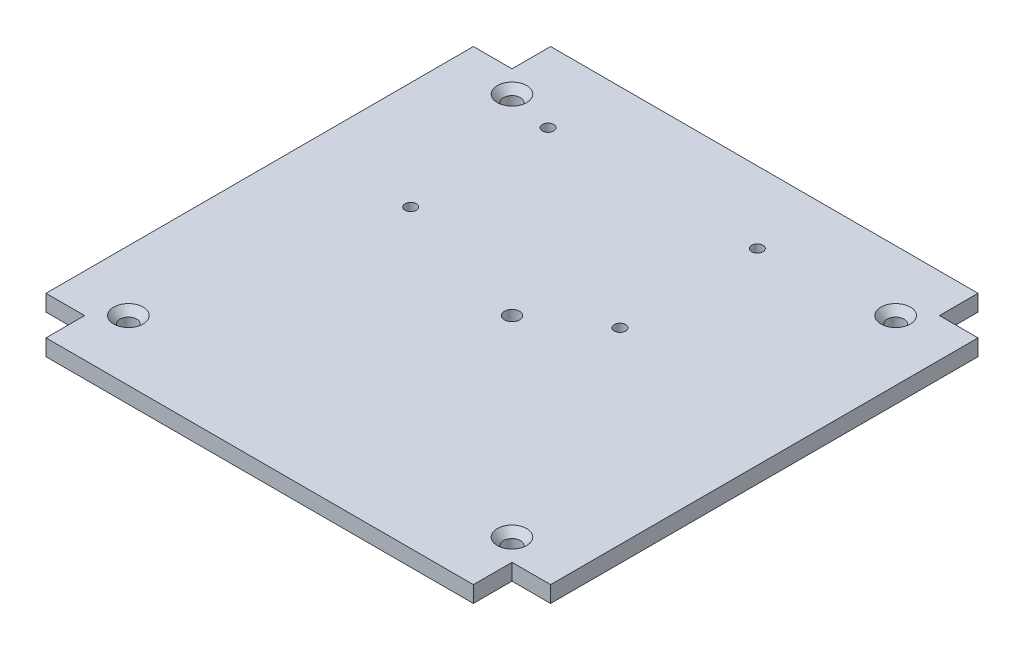
from build123d import *

# Parameters (mm, degrees)
SKETCH1_W                                     = 98
SKETCH1_H                                     = 98
BOSS_EXTRUDE1_DEPTH                           = 3.175
SKETCH2_W                                     = 7.5
SKETCH2_H                                     = 7.5
CUT_EXTRUDE1_DEPTH                            = 70.369161917
F_4_CLEARANCE_HOLE1_D                         = 2.9464
M2_CLEARANCE_HOLE1_D                          = 2.2
CSK_FOR_4_FLAT_HEAD_MACHINE_SCREW1_AT_2_COUNT = 2
CSK_FOR_4_FLAT_HEAD_MACHINE_SCREW1_AT_2_PITCH = 74.5
CSK_FOR_4_FLAT_HEAD_MACHINE_SCREW1_AT_3_COUNT = 2
CSK_FOR_4_FLAT_HEAD_MACHINE_SCREW1_AT_3_PITCH = 105.358910397
CSK_FOR_4_FLAT_HEAD_MACHINE_SCREW1_AT_4_COUNT = 2
CSK_FOR_4_FLAT_HEAD_MACHINE_SCREW1_AT_4_PITCH = 74.5


with BuildPart() as part:
    # Sketch1 → Boss-Extrude1 (new body)
    with BuildSketch(Plane(origin=(0, 0, 0), x_dir=(1, 0, 0), z_dir=(0, 1, 0))):
        Rectangle(SKETCH1_W, SKETCH1_H)
    extrude(amount=BOSS_EXTRUDE1_DEPTH)

    # Sketch2 → Cut-Extrude1 (cut, through all)
    with BuildSketch(Plane(origin=(0, 3.175, 0), x_dir=(1, 0, 0), z_dir=(0, 1, 0))):
        with Locations((45.25, 45.25)):
            Rectangle(SKETCH2_W, SKETCH2_H)
        with Locations((-45.25, 45.25)):
            Rectangle(SKETCH2_W, SKETCH2_H)
        with Locations((45.25, -45.25)):
            Rectangle(SKETCH2_W, SKETCH2_H)
        with Locations((-45.25, -45.25)):
            Rectangle(SKETCH2_W, SKETCH2_H)
    extrude(amount=-CUT_EXTRUDE1_DEPTH, mode=Mode.SUBTRACT)

    # #4 Clearance Hole1 (through all)
    with Locations(Plane(origin=(0, 3.175, 0), x_dir=(1, 0, 0), z_dir=(0, 1, 0))):
        with Locations((0, 0)):
            Hole(F_4_CLEARANCE_HOLE1_D / 2)

    # M2 Clearance Hole1 (through all)
    with Locations(Plane(origin=(0, 3.175, 0), x_dir=(1, 0, 0), z_dir=(0, 1, 0))):
        with Locations((-28.095, 35.095), (12.545, 35.095), (12.545, 8.425), (-28.095, 8.425)):
            Hole(M2_CLEARANCE_HOLE1_D / 2)

    # Sketch9 → CSK for #4 Flat Head Machine Screw1 (revolve, cut)
    with BuildSketch(Plane(origin=(37.25, 3.175, 37.25), x_dir=(0, 0, 1), z_dir=(1, 0, 0))):
        Polygon((0, 0), (0, 3.175), (1.63195, 3.175), (1.63195, 1.409834001), (2.8575, 0), align=None)
    csk_for_4_flat_head_machine_screw1 = revolve(axis=Axis((37.25, 9.525, 37.25), (0, -1, 0)), mode=Mode.SUBTRACT)

    # CSK for #4 Flat Head Machine Screw1 at 2: CSK for #4 Flat Head Machine Screw1 ×2
    with Locations(*[(-i * CSK_FOR_4_FLAT_HEAD_MACHINE_SCREW1_AT_2_PITCH, 0, 0) for i in range(1, CSK_FOR_4_FLAT_HEAD_MACHINE_SCREW1_AT_2_COUNT)]):
        add(csk_for_4_flat_head_machine_screw1, mode=Mode.SUBTRACT)

    # CSK for #4 Flat Head Machine Screw1 at 3: CSK for #4 Flat Head Machine Screw1 ×2
    with Locations(*[Vector(-0.7071067811865502, 0, -0.7071067811865448) * (i * CSK_FOR_4_FLAT_HEAD_MACHINE_SCREW1_AT_3_PITCH) for i in range(1, CSK_FOR_4_FLAT_HEAD_MACHINE_SCREW1_AT_3_COUNT)]):
        add(csk_for_4_flat_head_machine_screw1, mode=Mode.SUBTRACT)

    # CSK for #4 Flat Head Machine Screw1 at 4: CSK for #4 Flat Head Machine Screw1 ×2
    with Locations(*[(0, 0, -i * CSK_FOR_4_FLAT_HEAD_MACHINE_SCREW1_AT_4_PITCH) for i in range(1, CSK_FOR_4_FLAT_HEAD_MACHINE_SCREW1_AT_4_COUNT)]):
        add(csk_for_4_flat_head_machine_screw1, mode=Mode.SUBTRACT)


solid = part.part
